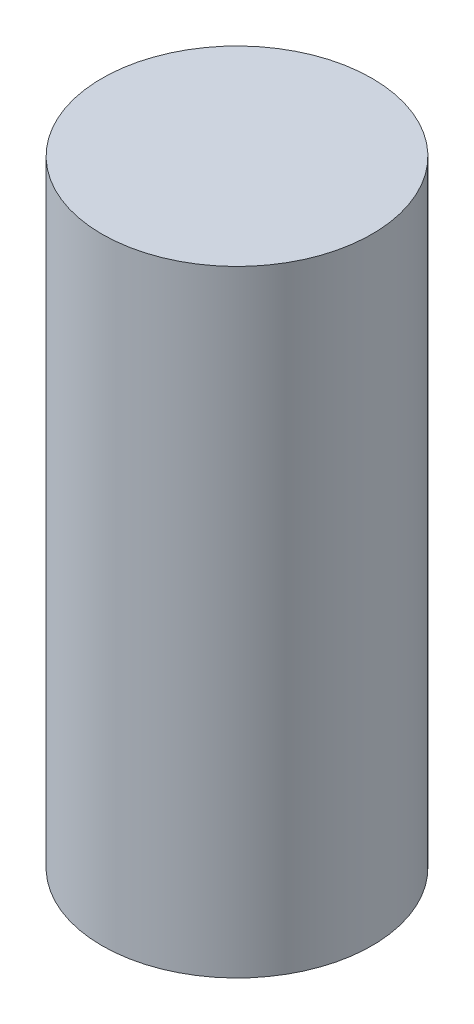
from build123d import *

# Parameters (mm, degrees)
SKETCH_1_R      = 13.585
EXTRUDE_1_DEPTH = 62


with BuildPart() as part:
    # 草图1 → 凸台-拉伸1 (new body)
    with BuildSketch(Plane(origin=(0, 0, 0), x_dir=(1, 0, 0), z_dir=(0, 1, 0))):
        with Locations(Location((0, 0, 0), (0, 0, 270))):
            Circle(SKETCH_1_R)
    extrude(amount=EXTRUDE_1_DEPTH)

    # 草图2 → 旋转1 (revolve)
    with BuildSketch(Plane.XY, mode=Mode.PRIVATE) as revolve_1_sk:
        Polygon((2.339013215, -6), (2.739013215, -6), (3.339013215, -4), (2.739013215, -4), (3.339013215, -2), (2.739013215, -2), (3.339013215, 0), (2.339013215, 0), align=None)
    revolve(revolve_1_sk.sketch.rotate(Axis((0, 0, 0), (0, -1, 0)), 90), axis=Axis((0, 0, 0), (0, -1, 0)))


solid = part.part
